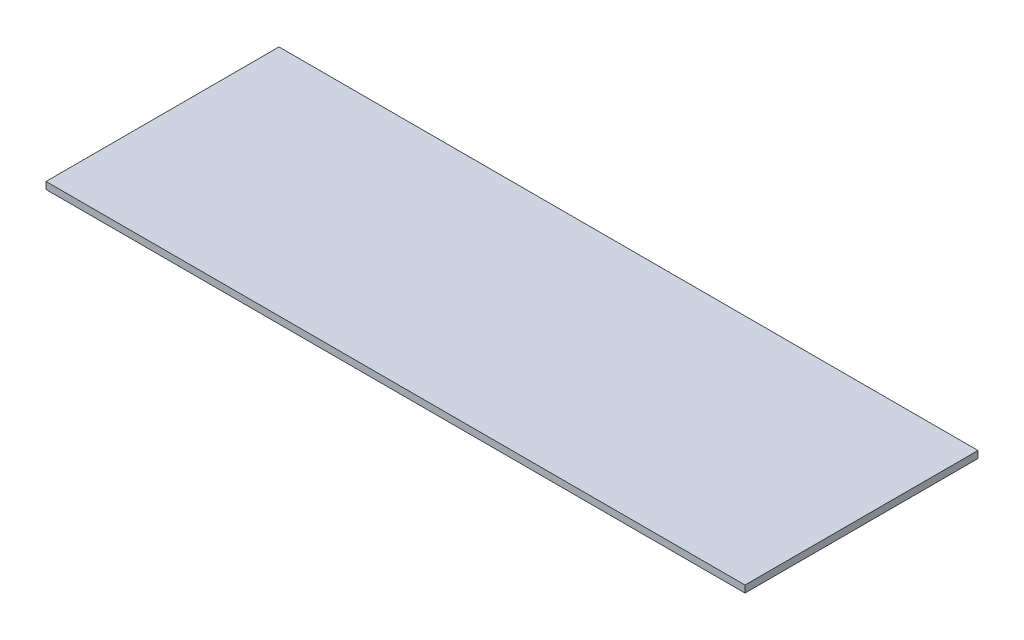
from build123d import *

# Parameters (mm, degrees)
SKETCH1_W           = 300
SKETCH1_H           = 100
BOSS_EXTRUDE1_DEPTH = 3


with BuildPart() as part:
    # Sketch1 → Boss-Extrude1 (new body)
    with BuildSketch(Plane(origin=(0, 0, 0), x_dir=(1, 0, 0), z_dir=(0, 1, 0))):
        with Locations((140.056818182, -31.505681818)):
            Rectangle(SKETCH1_W, SKETCH1_H)
    extrude(amount=BOSS_EXTRUDE1_DEPTH)


solid = part.part
